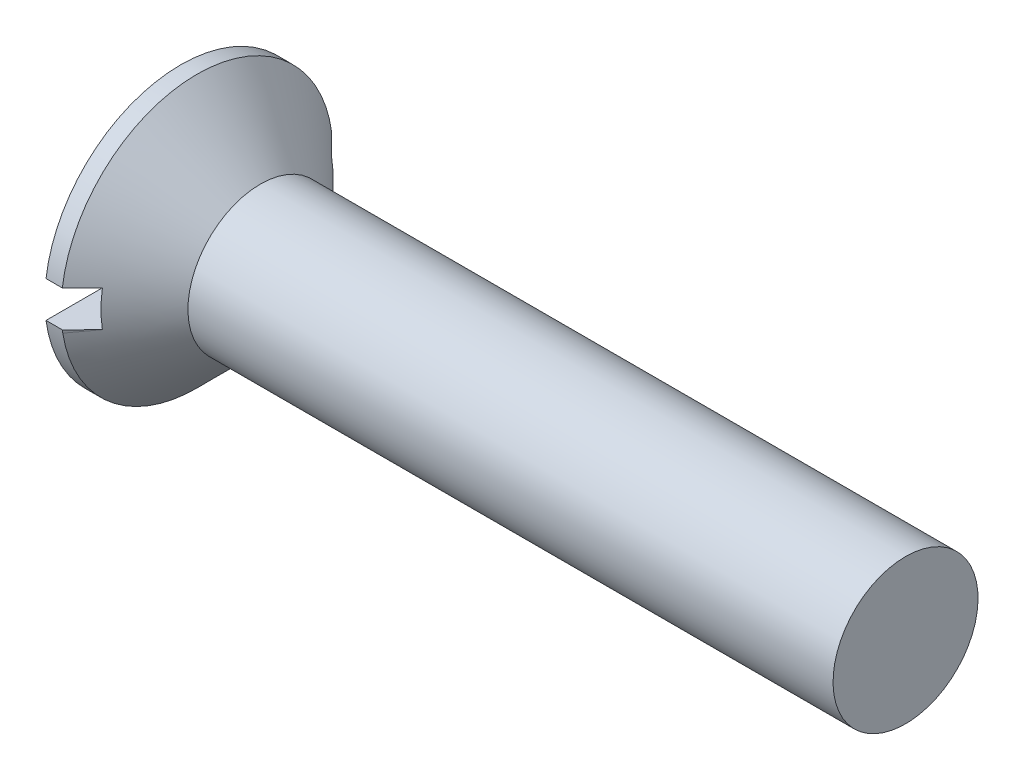
from build123d import *

# Parameters (mm, degrees)
SKETCH2_W          = 7.5
SKETCH2_H          = 1
CUT_EXTRUDE1_DEPTH = 1


with BuildPart() as part:
    # Sketch1 → Revolve1 (revolve)
    with BuildSketch(Plane.XY):
        Polygon((0, 0), (0, 3.75), (0.45, 3.75), (2.2, 2), (20, 2), (20, 0), align=None)
    revolve(axis=Axis((20, 0, 0), (-1, 0, 0)))

    # Sketch2 → Cut-Extrude1 (cut)
    with BuildSketch(Plane.ZY):
        Rectangle(SKETCH2_W, SKETCH2_H)
    extrude(amount=-CUT_EXTRUDE1_DEPTH, mode=Mode.SUBTRACT)


solid = part.part
